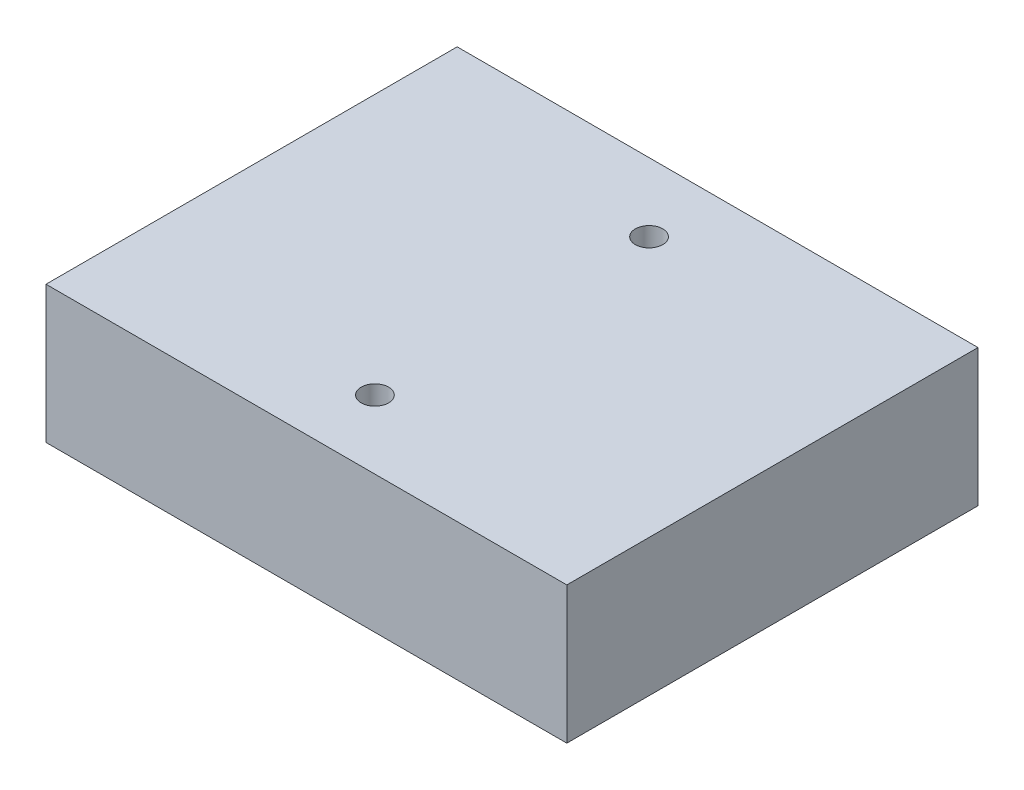
from build123d import *

# Parameters (mm, degrees)
SKETCH1_W           = 76
SKETCH1_H           = 60
SKETCH1_R           = 2
BOSS_EXTRUDE1_DEPTH = 20


with BuildPart() as part:
    # Sketch1 → Boss-Extrude1 (new body)
    with BuildSketch(Plane(origin=(0, 0, 0), x_dir=(1, 0, 0), z_dir=(0, 1, 0))):
        with Locations((65.514202899, 28.751304348)):
            Rectangle(SKETCH1_W, SKETCH1_H)
        with Locations(Location((65.514202899, 8.751304348, 0), (0, 0, 270))):
            Circle(SKETCH1_R, mode=Mode.SUBTRACT)
        with Locations(Location((65.514202899, 48.751304348, 0), (0, 0, 270))):
            Circle(SKETCH1_R, mode=Mode.SUBTRACT)
    extrude(amount=BOSS_EXTRUDE1_DEPTH)


solid = part.part
